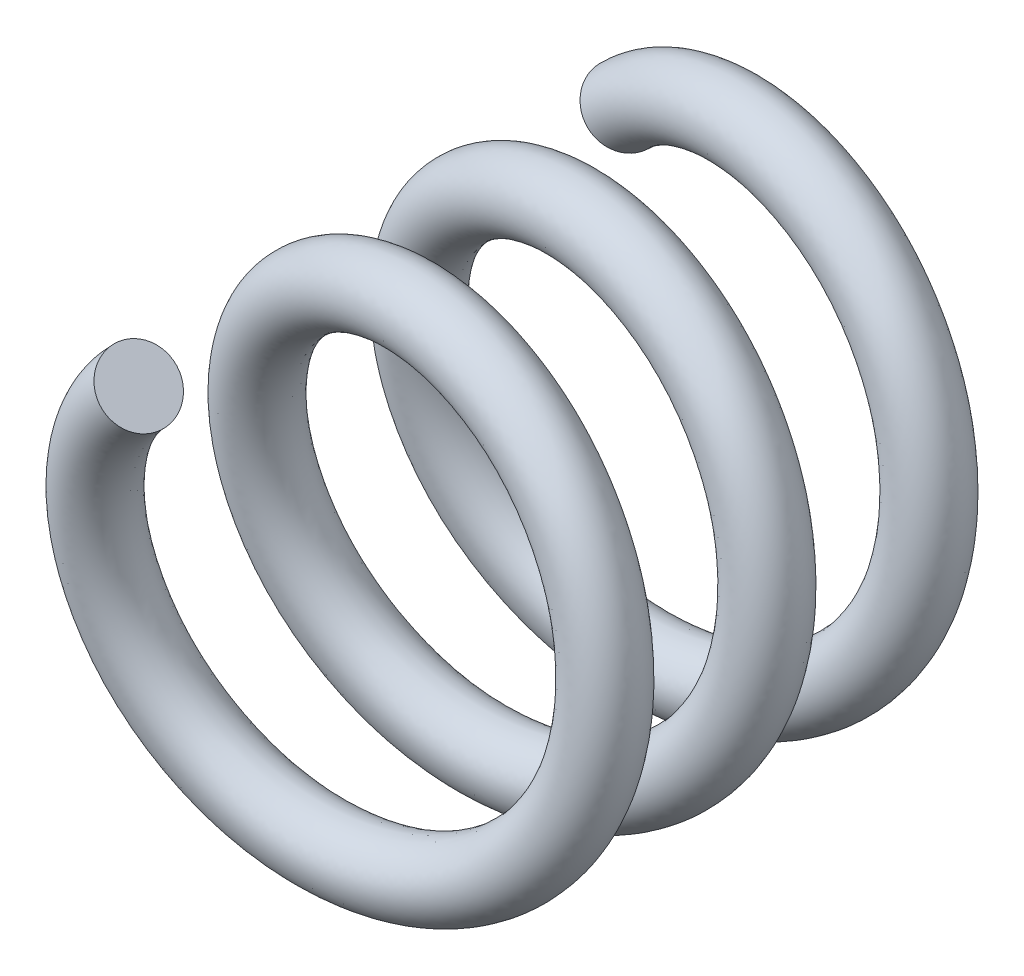
from build123d import *

# Parameters (mm, degrees)
SWEEP1_PITCH       = 2.333333333
SWEEP1_HEIGHT      = 7
SWEEP1_RADIUS      = 3.065
SWEEP1_START_ANGLE = 135
SKETCH3_R          = 0.5


with BuildPart() as part:
    # Sweep1: sweep along a helix
    with BuildLine() as sweep1_path:
        add(Helix(SWEEP1_PITCH, SWEEP1_HEIGHT, SWEEP1_RADIUS, center=(0, 0, 0), direction=(0, 0, 1), lefthand=True, mode=Mode.PRIVATE).rotate(Axis((0, 0, 0), (0, 0, 1)), SWEEP1_START_ANGLE))
    # Sketch3 → Sweep1 (sweep)
    with BuildSketch(Plane(origin=(-2.167282284, 2.167282284, 0), x_dir=(0.7121603158938707, -0.6899861351617507, -0.12940949636905552), z_dir=(0.7019729911706502, 0.7019729911706566, 0.12028233176095218))):
        Circle(SKETCH3_R)
    sweep(path=sweep1_path.line, is_frenet=True)


solid = part.part
